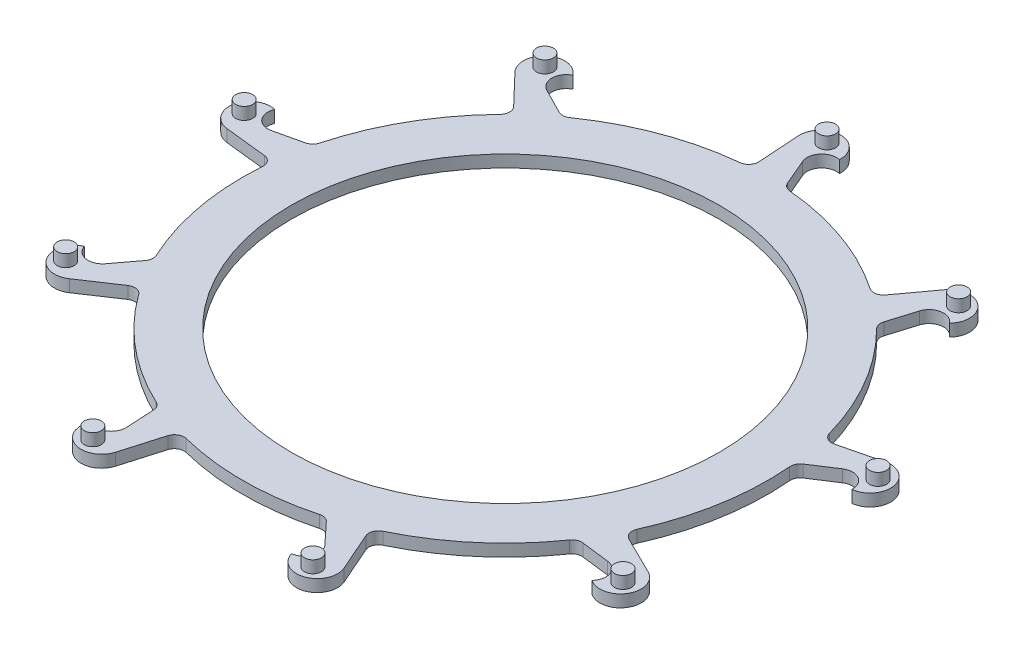
from build123d import *

# Parameters (mm, degrees)
SKETCH1_R           = 68.659375
SKETCH1_R_2         = 55.959375
BOSS_EXTRUDE1_DEPTH = 3.175
BOSS_EXTRUDE2_START = -3.175
BOSS_EXTRUDE2_DEPTH = 3.175
CIRPATTERN1_COUNT   = 9
SKETCH3_R           = 2.2225
BOSS_EXTRUDE3_DEPTH = 3.175
CIRPATTERN13_COUNT  = 9


with BuildPart() as part:
    # Sketch1 → Boss-Extrude1 (new body)
    with BuildSketch(Plane(origin=(0, 0, 0), x_dir=(1, 0, 0), z_dir=(0, 1, 0))):
        with Locations(Location((0, 0, 0), (0, 0, 270))):
            Circle(SKETCH1_R)
        with Locations(Location((0, 0, 0), (0, 0, 270))):
            Circle(SKETCH1_R_2, mode=Mode.SUBTRACT)
    extrude(amount=BOSS_EXTRUDE1_DEPTH)

    # Sketch2 → Boss-Extrude2 (add)
    with BuildSketch(Plane(origin=(0, 3.175, 0), x_dir=(1, 0, 0), z_dir=(0, 1, 0)).offset(BOSS_EXTRUDE2_START)):
        with BuildLine():
            Line((-4.653697789, 71.001707707), (-5.372788209, 81.972907412))
            ThreePointArc((-5.372788209, 81.972907412), (0, 87.709375), (5.372788209, 81.972907412))
            ThreePointArc((5.372788209, 81.972907412), (1.580107525, 80.725221164), (0.983574692, 76.777399446))
            Line((0.983574692, 76.777399446), (3.889375, 69.933810414))
            ThreePointArc((3.889375, 69.933810414), (4.734169071, 68.871766239), (6.005193091, 68.39625305))
            ThreePointArc((6.005193091, 68.39625305), (-0.46538454, 68.657797755), (-6.931822104, 68.308561818))
            ThreePointArc((-6.931822104, 68.308561818), (-5.249012804, 69.195180628), (-4.653697789, 71.001707707))
        make_face()
    boss_extrude2 = extrude(amount=BOSS_EXTRUDE2_DEPTH)

    # CirPattern1: Boss-Extrude2 ×9 about axis
    cirpattern1_axis = Axis((0, 0, 0), (0, 1, 0))
    for i in range(1, CIRPATTERN1_COUNT):
        add(boss_extrude2.rotate(cirpattern1_axis, i * 360 / CIRPATTERN1_COUNT))

    # Sketch3 → Boss-Extrude3 (add)
    with BuildSketch(Plane(origin=(0, 3.175, 0), x_dir=(1, 0, 0), z_dir=(0, 1, 0))):
        with Locations(Location((0, 84.132166, 0), (0, 0, 270))):
            Circle(SKETCH3_R)
    boss_extrude3 = extrude(amount=BOSS_EXTRUDE3_DEPTH)

    # CirPattern13: Boss-Extrude3 ×9 about axis
    cirpattern13_axis = Axis((0, 0, 0), (0, 1, 0))
    for i in range(1, CIRPATTERN13_COUNT):
        add(boss_extrude3.rotate(cirpattern13_axis, i * 360 / CIRPATTERN13_COUNT))


solid = part.part
